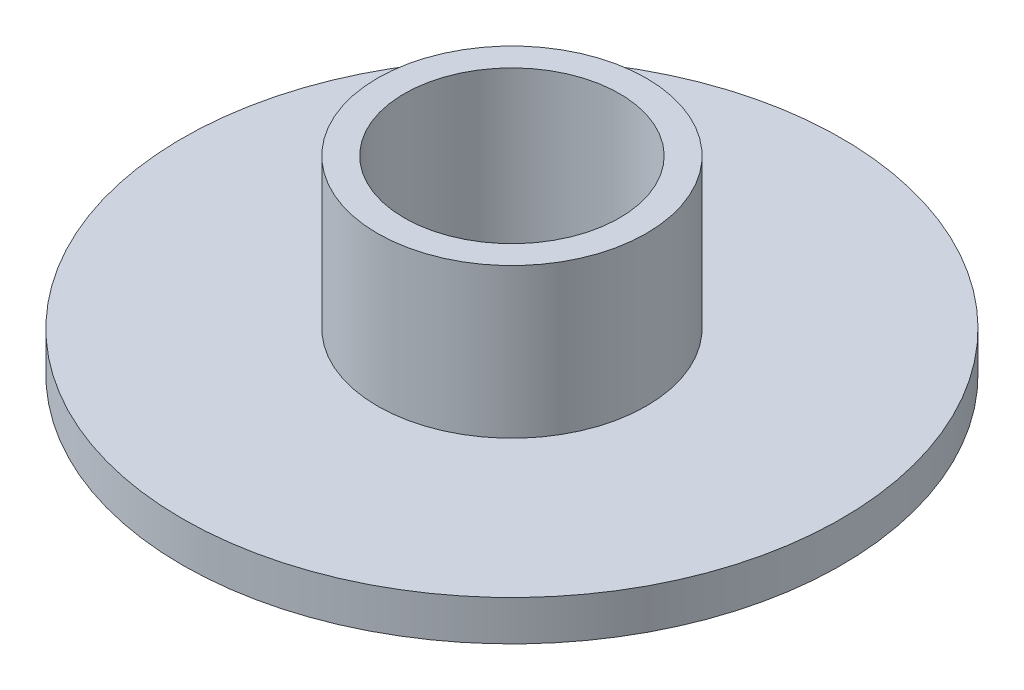
from build123d import *


with BuildPart() as part:
    # Sketch12 → Revolve1 (revolve)
    with BuildSketch(Plane.XY, mode=Mode.PRIVATE) as revolve1_sk:
        Polygon((0, 43.188415764), (0, 0), (52.597229294, 0), (52.597229294, 9.525), (6.35, 9.525), (6.35, 44.968998076), (0, 44.968998076), align=None)
    revolve(revolve1_sk.sketch.rotate(Axis((-25.525819638, 53.426764057, 0), (0, -1, 0)), 90), axis=Axis((-25.525819638, 53.426764057, 0), (0, -1, 0)))


solid = part.part
